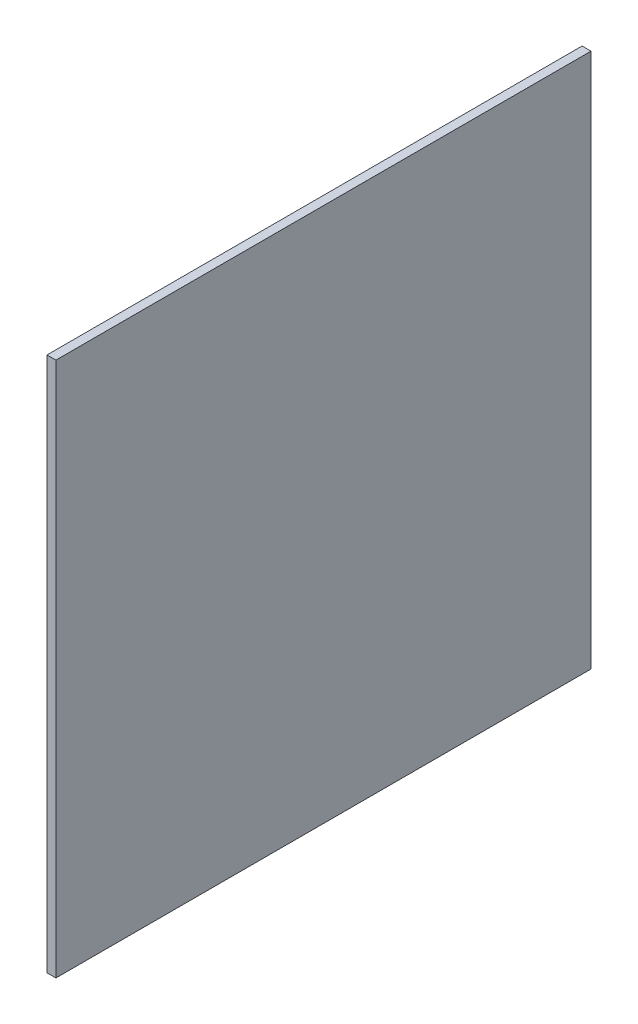
from build123d import *

# Parameters (mm, degrees)
SKETCH1_W           = 600
SKETCH1_H           = 600
BOSS_EXTRUDE1_DEPTH = 10


with BuildPart() as part:
    # Sketch1 → Boss-Extrude1 (new body)
    with BuildSketch(Plane(origin=(0, 0, 0), x_dir=(0, 0, -1), z_dir=(1, 0, 0))):
        Rectangle(SKETCH1_W, SKETCH1_H)
    extrude(amount=BOSS_EXTRUDE1_DEPTH)


solid = part.part
